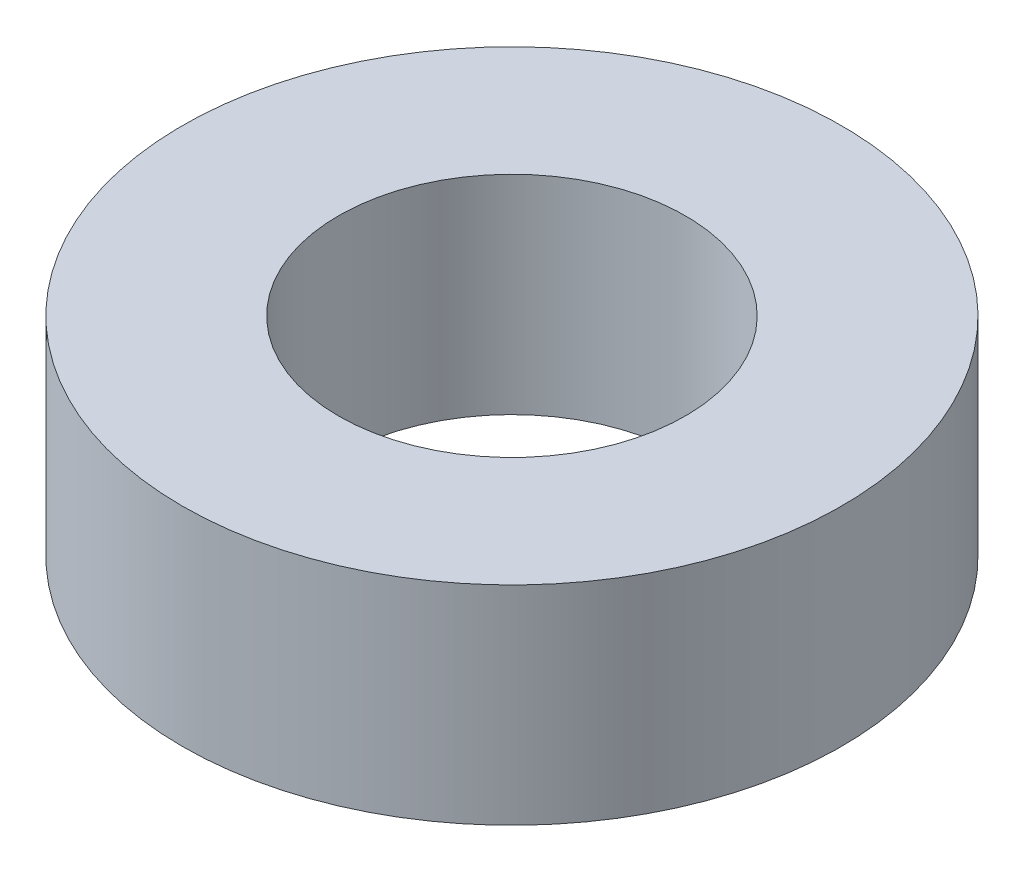
from build123d import *

# Parameters (mm, degrees)
SKETCH1_R      = 4.75
EXTRUDE1_DEPTH = 3
SKETCH2_R      = 2.5
EXTRUDE2_DEPTH = 8.356969485


with BuildPart() as part:
    # Sketch1 → Extrude1 (new body)
    with BuildSketch(Plane(origin=(0, 0, 0), x_dir=(1, 0, 0), z_dir=(0, 1, 0))):
        Circle(SKETCH1_R)
    extrude(amount=EXTRUDE1_DEPTH)

    # Sketch2 → Extrude2 (cut, through all)
    with BuildSketch(Plane(origin=(0, 3, 0), x_dir=(1, 0, 0), z_dir=(0, 1, 0))):
        Circle(SKETCH2_R)
    extrude(amount=-EXTRUDE2_DEPTH, mode=Mode.SUBTRACT)


solid = part.part
